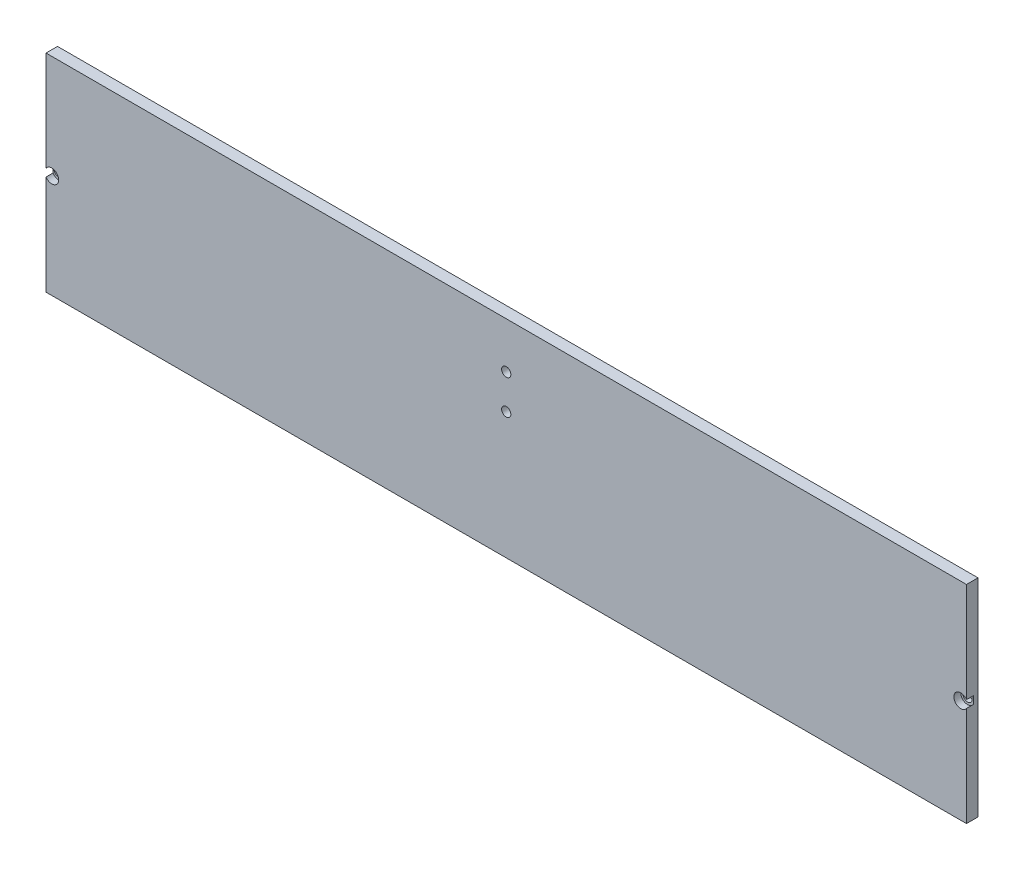
from build123d import *

# Parameters (mm, degrees)
SKETCH1_W           = 400
SKETCH1_H           = 90
SKETCH1_R           = 2
BOSS_EXTRUDE2_DEPTH = 5
SKETCH2_R           = 3
CUT_EXTRUDE1_DEPTH  = 3
SKETCH3_R           = 1.25
CUT_EXTRUDE2_DEPTH  = 15


with BuildPart() as part:
    # Sketch1 → Boss-Extrude2 (new body)
    with BuildSketch(Plane.XY):
        with Locations((200, 45)):
            Rectangle(SKETCH1_W, SKETCH1_H)
        with Locations((2.5, 45)):
            Circle(SKETCH1_R, mode=Mode.SUBTRACT)
        with Locations((397.5, 45)):
            Circle(SKETCH1_R, mode=Mode.SUBTRACT)
        with Locations((200, 55)):
            Circle(SKETCH1_R, mode=Mode.SUBTRACT)
        with Locations((200, 70)):
            Circle(SKETCH1_R, mode=Mode.SUBTRACT)
    extrude(amount=BOSS_EXTRUDE2_DEPTH)

    # Sketch2 → Cut-Extrude1 (cut)
    with BuildSketch(Plane.XY.offset(5)):
        with Locations((2.5, 45)):
            Circle(SKETCH2_R)
        with Locations((397.5, 45)):
            Circle(SKETCH2_R)
    extrude(amount=-CUT_EXTRUDE1_DEPTH, mode=Mode.SUBTRACT)

    # Sketch3 → Cut-Extrude2 (cut)
    with BuildSketch(Plane.XZ):
        with Locations(Location((40, 2.5, 0), (0, 0, 270))):
            Circle(SKETCH3_R)
        with Locations(Location((360, 2.5, 0), (0, 0, 270))):
            Circle(SKETCH3_R)
    extrude(amount=-CUT_EXTRUDE2_DEPTH, mode=Mode.SUBTRACT)


solid = part.part
